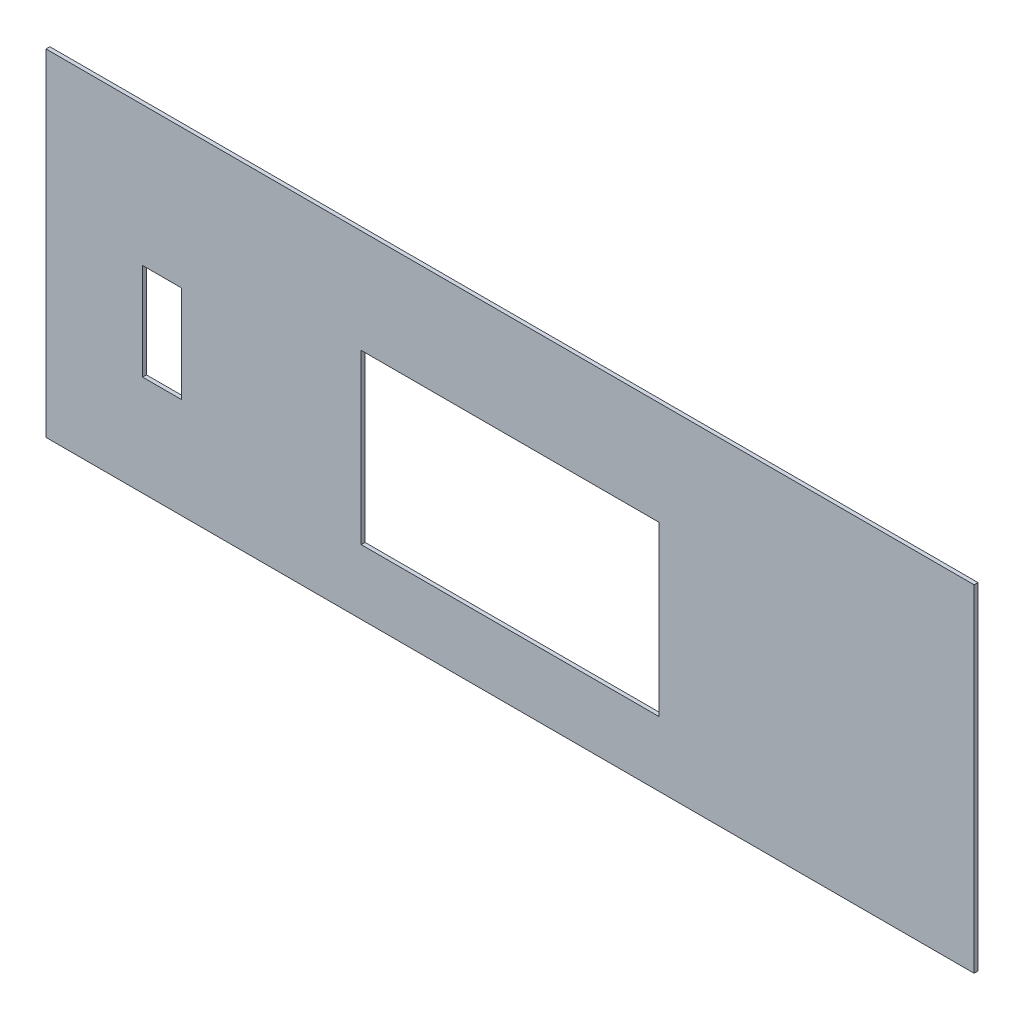
from build123d import *

# Parameters (mm, degrees)
SKETCH1_W           = 480
SKETCH1_H           = 174
SKETCH1_W_2         = 154
SKETCH1_H_2         = 87
SKETCH1_W_3         = 20
SKETCH1_H_3         = 50
BOSS_EXTRUDE1_DEPTH = 2


with BuildPart() as part:
    # Sketch1 → Boss-Extrude1 (new body)
    with BuildSketch(Plane.XY):
        Rectangle(SKETCH1_W, SKETCH1_H)
        with Locations((0, -10)):
            Rectangle(SKETCH1_W_2, SKETCH1_H_2, mode=Mode.SUBTRACT)
        with Locations((-180, -10)):
            Rectangle(SKETCH1_W_3, SKETCH1_H_3, mode=Mode.SUBTRACT)
    extrude(amount=-BOSS_EXTRUDE1_DEPTH)


solid = part.part
